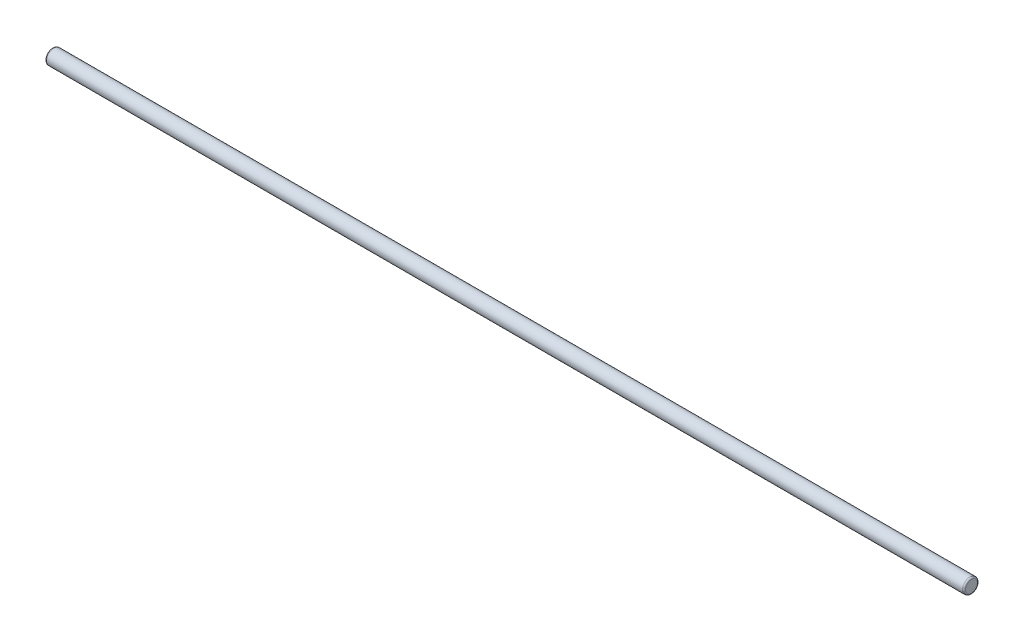
from build123d import *

# Parameters (mm, degrees)
SKETCH1_R           = 5
BOSS_EXTRUDE1_DEPTH = 310
FILLET2_R           = 1


with BuildPart() as part:
    # Sketch1 → Boss-Extrude1 (new, symmetric)
    with BuildSketch(Plane.YZ):
        with Locations(Location((0, 0, 0), (0, 0, 270))):
            Circle(SKETCH1_R)
    extrude(amount=BOSS_EXTRUDE1_DEPTH, both=True)

    # Fillet2
    fillet2_edges = [part.edges().sort_by_distance(p)[0] for p in [
        (-310, 0, 5),
        (310, 0, 5),
    ]]
    fillet(fillet2_edges, radius=FILLET2_R)


solid = part.part
